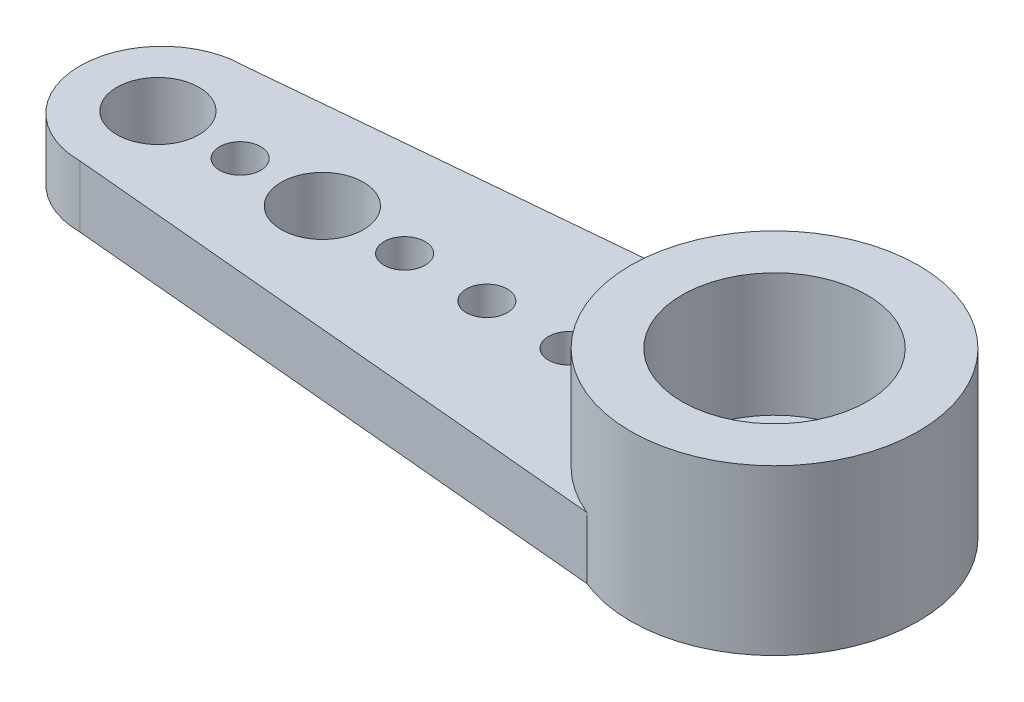
from build123d import *

# Parameters (mm, degrees)
SKETCH1_R           = 3.5
BOSS_EXTRUDE1_DEPTH = 4
BOSS_EXTRUDE2_DEPTH = 1.5
SKETCH7_R           = 2.5
CUT_EXTRUDE4_DEPTH  = 0.6
SKETCH8_R           = 2.25
CUT_EXTRUDE5_DEPTH  = 3
SKETCH9_R           = 1
CUT_EXTRUDE6_DEPTH  = 18.590338257
SKETCH10_R          = 1
SKETCH10_R_2        = 0.5
CUT_EXTRUDE7_DEPTH  = 18.716094378


with BuildPart() as part:
    # Sketch1 → Boss-Extrude1 (new body)
    with BuildSketch(Plane(origin=(0, 0, 0), x_dir=(1, 0, 0), z_dir=(0, 1, 0))):
        with Locations(Location((0, 0, 0), (0, 0, 270))):
            Circle(SKETCH1_R)
    extrude(amount=BOSS_EXTRUDE1_DEPTH)

    # Sketch6 → Boss-Extrude2 (add)
    with BuildSketch(Plane.XZ):
        with BuildLine():
            Line((-14.9, 2), (-0.65, 3.301402389))
            Line((-0.65, 3.301402389), (0, 3.5))
            Line((0, 3.5), (0, -3.5))
            Line((0, -3.5), (-0.65, -3.301402389))
            Line((-0.65, -3.301402389), (-14.9, -2))
            ThreePointArc((-14.9, -2), (-16.9, 0), (-14.9, 2))
        make_face()
    extrude(amount=-BOSS_EXTRUDE2_DEPTH)

    # Sketch7 → Cut-Extrude4 (cut)
    with BuildSketch(Plane.XZ):
        with Locations(Location((0, 0, 0), (0, 0, 270))):
            Circle(SKETCH7_R)
    extrude(amount=-CUT_EXTRUDE4_DEPTH, mode=Mode.SUBTRACT)

    # Sketch8 → Cut-Extrude5 (cut)
    with BuildSketch(Plane(origin=(0, 4, 0), x_dir=(1, 0, 0), z_dir=(0, 1, 0))):
        with Locations(Location((0, 0, 0), (0, 0, 270))):
            Circle(SKETCH8_R)
    extrude(amount=-CUT_EXTRUDE5_DEPTH, mode=Mode.SUBTRACT)

    # Sketch9 → Cut-Extrude6 (cut, through all)
    with BuildSketch(Plane.XZ.offset(-0.6)):
        with Locations(Location((0, 0, 0), (0, 0, 270))):
            Circle(SKETCH9_R)
    extrude(amount=-CUT_EXTRUDE6_DEPTH, mode=Mode.SUBTRACT)

    # Sketch10 → Cut-Extrude7 (cut, through all)
    with BuildSketch(Plane.XZ):
        with Locations(Location((-15, 0, 0), (0, 0, 270))):
            Circle(SKETCH10_R)
        with Locations(Location((-13, 0, 0), (0, 0, 270))):
            Circle(SKETCH10_R_2)
        with Locations(Location((-11, 0, 0), (0, 0, 270))):
            Circle(SKETCH10_R)
        with Locations(Location((-9, 0, 0), (0, 0, 270))):
            Circle(SKETCH10_R_2)
        with Locations(Location((-7, 0, 0), (0, 0, 270))):
            Circle(SKETCH10_R_2)
        with Locations(Location((-5, 0, 0), (0, 0, 270))):
            Circle(SKETCH10_R_2)
    extrude(amount=-CUT_EXTRUDE7_DEPTH, mode=Mode.SUBTRACT)


solid = part.part
